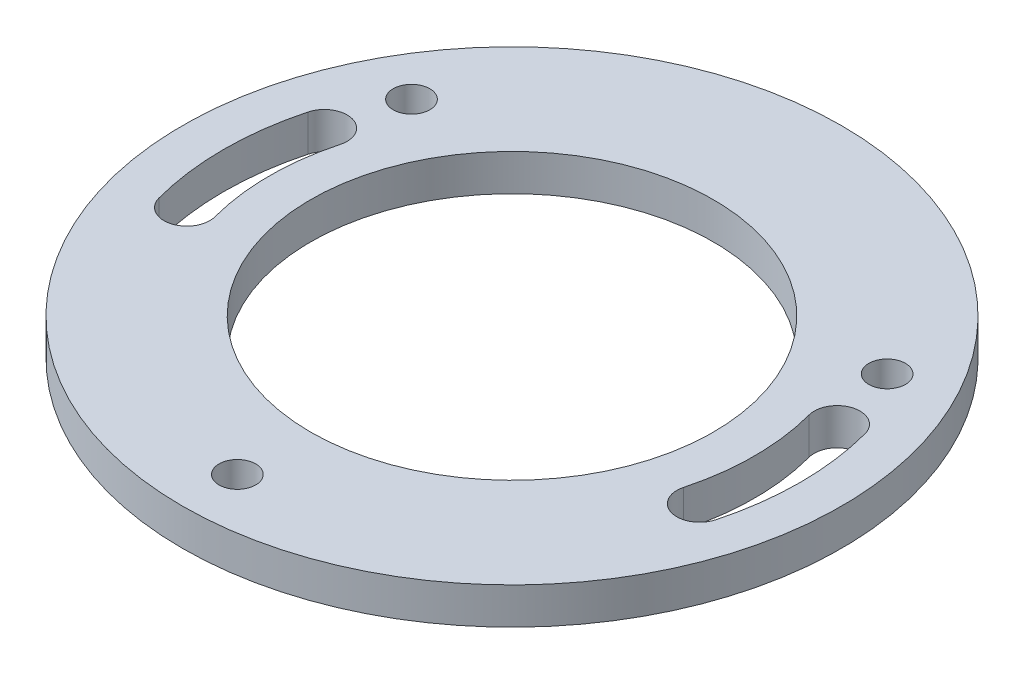
from build123d import *

# Parameters (mm, degrees)
SKETCH_1_R      = 36
SKETCH_1_R_2    = 22
SKETCH_1_R_3    = 2
EXTRUDE_1_DEPTH = 4


with BuildPart() as part:
    # 草图1 → 凸台-拉伸1 (new body)
    with BuildSketch(Plane(origin=(0, 0, 0), x_dir=(1, 0, 0), z_dir=(0, 1, 0))):
        with Locations(Location((0, 0, 0), (0, 0, 270))):
            Circle(SKETCH_1_R)
        with Locations(Location((0, 0, 0), (0, 0, 270))):
            Circle(SKETCH_1_R_2, mode=Mode.SUBTRACT)
        with Locations(Location((-25.980762114, 15, 0), (0, 0, 270))):
            Circle(SKETCH_1_R_3, mode=Mode.SUBTRACT)
        with Locations(Location((25.980762114, 15, 0), (0, 0, 270))):
            Circle(SKETCH_1_R_3, mode=Mode.SUBTRACT)
        with Locations(Location((0, -30, 0), (0, 0, 270))):
            Circle(SKETCH_1_R_3, mode=Mode.SUBTRACT)
        with BuildLine():
            ThreePointArc((-30.426663528, 8.152799921), (-31.5, 0), (-30.426663528, -8.152799921))
            ThreePointArc((-30.426663528, -8.152799921), (-27.36480135, -9.920566874), (-25.597034397, -6.858704695))
            ThreePointArc((-25.597034397, -6.858704695), (-26.5, 0), (-25.597034397, 6.858704695))
            ThreePointArc((-25.597034397, 6.858704695), (-27.36480135, 9.920566874), (-30.426663528, 8.152799921))
        make_face(mode=Mode.SUBTRACT)
        with BuildLine():
            ThreePointArc((30.426663528, 8.152799921), (31.5, 0), (30.426663528, -8.152799921))
            ThreePointArc((30.426663528, -8.152799921), (27.36480135, -9.920566874), (25.597034397, -6.858704695))
            ThreePointArc((25.597034397, -6.858704695), (26.5, 0), (25.597034397, 6.858704695))
            ThreePointArc((25.597034397, 6.858704695), (27.36480135, 9.920566874), (30.426663528, 8.152799921))
        make_face(mode=Mode.SUBTRACT)
    extrude(amount=EXTRUDE_1_DEPTH)


solid = part.part
